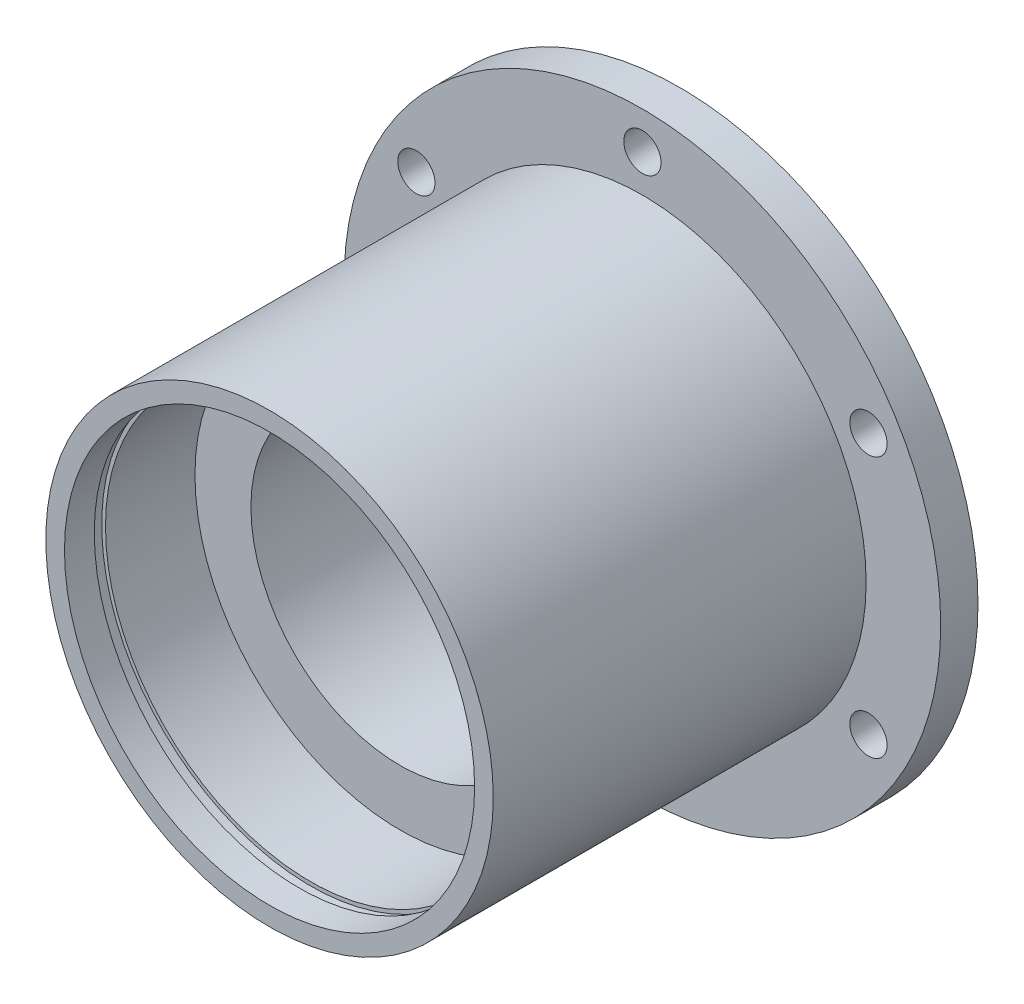
from build123d import *
from build123d.topology import SkipClean

# Parameters (mm, degrees)
SKETCH1_R                = 40
SKETCH1_R_2              = 2.5
BOSS_EXTRUDE1_DEPTH      = 5
SKETCH2_R                = 30
SKETCH2_R_2              = 27.5
BOSS_EXTRUDE2_DEPTH      = 50
SKETCH3_R                = 27.5
CUT_EXTRUDE1_DEPTH       = 50
BOSS_EXTRUDE4_DEPTH      = 10
BOSS_EXTRUDE4_DEPTH_BACK = 10
SKETCH5_R                = 27.5
SKETCH5_R_2              = 20
CUT_EXTRUDE2_START       = 12
SKETCH6_R                = 28
CUT_EXTRUDE2_DEPTH       = 1.5
CUT_EXTRUDE3_START       = 13.5
SKETCH7_R                = 28
CUT_EXTRUDE3_DEPTH       = 1.5


with BuildPart() as part:
    # Sketch1 → Boss-Extrude1 (new body)
    with BuildSketch(Plane.XY):
        Circle(SKETCH1_R)
        with Locations((0, 35)):
            Circle(SKETCH1_R_2, mode=Mode.SUBTRACT)
        with Locations((30.310889132, 17.5)):
            Circle(SKETCH1_R_2, mode=Mode.SUBTRACT)
        with Locations((30.310889132, -17.5)):
            Circle(SKETCH1_R_2, mode=Mode.SUBTRACT)
        with Locations((0, -35)):
            Circle(SKETCH1_R_2, mode=Mode.SUBTRACT)
        with Locations((-30.310889132, -17.5)):
            Circle(SKETCH1_R_2, mode=Mode.SUBTRACT)
        with Locations((-30.310889132, 17.5)):
            Circle(SKETCH1_R_2, mode=Mode.SUBTRACT)
    extrude(amount=BOSS_EXTRUDE1_DEPTH)

    # Sketch2 → Boss-Extrude2 (add)
    with BuildSketch(Plane.XY.offset(5)):
        Circle(SKETCH2_R)
        Circle(SKETCH2_R_2, mode=Mode.SUBTRACT)
    extrude(amount=BOSS_EXTRUDE2_DEPTH)

    # Sketch3 → Cut-Extrude1 (cut)
    with SkipClean():  # the faces are left unmerged after this step: merging them gives an invalid solid
        with BuildSketch(Plane(origin=(0, 0, 0), x_dir=(-1, 0, 0), z_dir=(0, 0, -1))):
            Circle(SKETCH3_R)
        extrude(amount=-CUT_EXTRUDE1_DEPTH, mode=Mode.SUBTRACT)

    # Sketch5 → Boss-Extrude4 (add, two sides: drawn at the far end of the back side and taken through both)
    with BuildSketch(Plane(origin=(0, 0, 27.5), x_dir=(-1, 0, 0), z_dir=(0, 0, -1)).offset(-BOSS_EXTRUDE4_DEPTH_BACK)):
        Circle(SKETCH5_R)
        Circle(SKETCH5_R_2, mode=Mode.SUBTRACT)
    extrude(amount=BOSS_EXTRUDE4_DEPTH + BOSS_EXTRUDE4_DEPTH_BACK)

    # Sketch6 → Cut-Extrude2 (cut)
    with BuildSketch(Plane(origin=(0, 0, 17.5), x_dir=(-1, 0, 0), z_dir=(0, 0, -1)).offset(CUT_EXTRUDE2_START)):
        with Locations(Location((0, 0, 0), (0, 0, 180))):
            Circle(SKETCH6_R)
    extrude(amount=CUT_EXTRUDE2_DEPTH, mode=Mode.SUBTRACT)

    # Sketch7 → Cut-Extrude3 (cut)
    with BuildSketch(Plane.XY.offset(37.5).offset(CUT_EXTRUDE3_START)):
        Circle(SKETCH7_R)
    extrude(amount=-CUT_EXTRUDE3_DEPTH, mode=Mode.SUBTRACT)


solid = part.part
